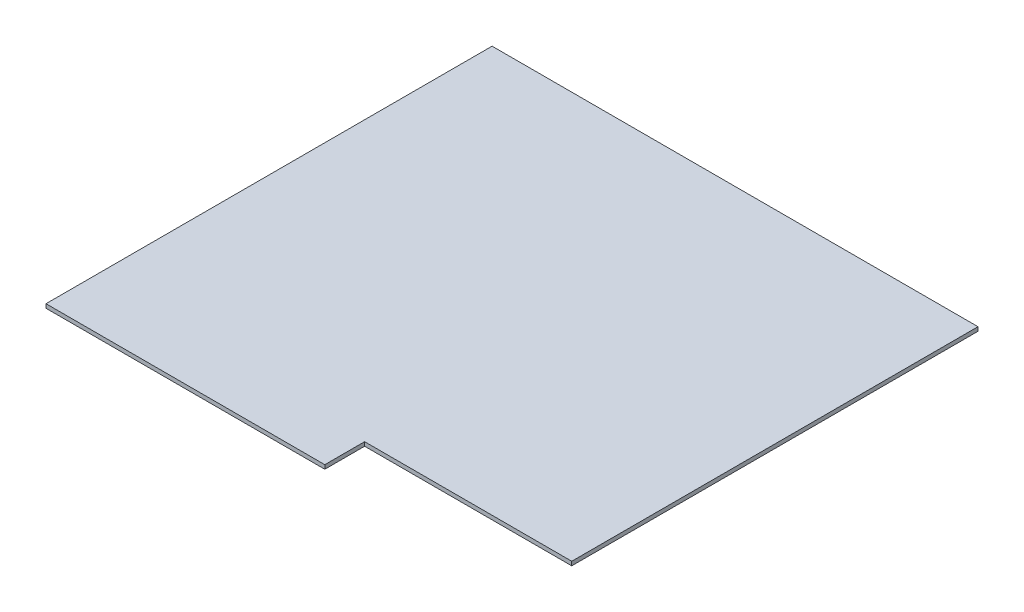
from build123d import *

# Parameters (mm, degrees)
BOSS_EXTRUDE1_DEPTH = 50
SKETCH2_W           = 750
SKETCH2_H           = 750
CUT_EXTRUDE1_DEPTH  = 10


with BuildPart() as part:
    # Sketch1 → Boss-Extrude1 (new body)
    with BuildSketch(Plane(origin=(0, 0, 0), x_dir=(1, 0, 0), z_dir=(0, 1, 0))):
        Polygon((521.343083485, -2869.080012749), (-2978.656916515, -2869.080012749), (-2978.656916515, 2730.919987251), (3121.343083485, 2730.919987251), (3121.343083485, -2369.080012749), (521.343083485, -2369.080012749), align=None)
    extrude(amount=BOSS_EXTRUDE1_DEPTH)

    # Sketch2 → Cut-Extrude1 (cut)
    with BuildSketch(Plane.XZ):
        with Locations((-1453.656916515, -180.919987251)):
            Rectangle(SKETCH2_W, SKETCH2_H)
        with Locations((1596.343083485, -180.919987251)):
            Rectangle(SKETCH2_W, SKETCH2_H)
    extrude(amount=-CUT_EXTRUDE1_DEPTH, mode=Mode.SUBTRACT)


solid = part.part
